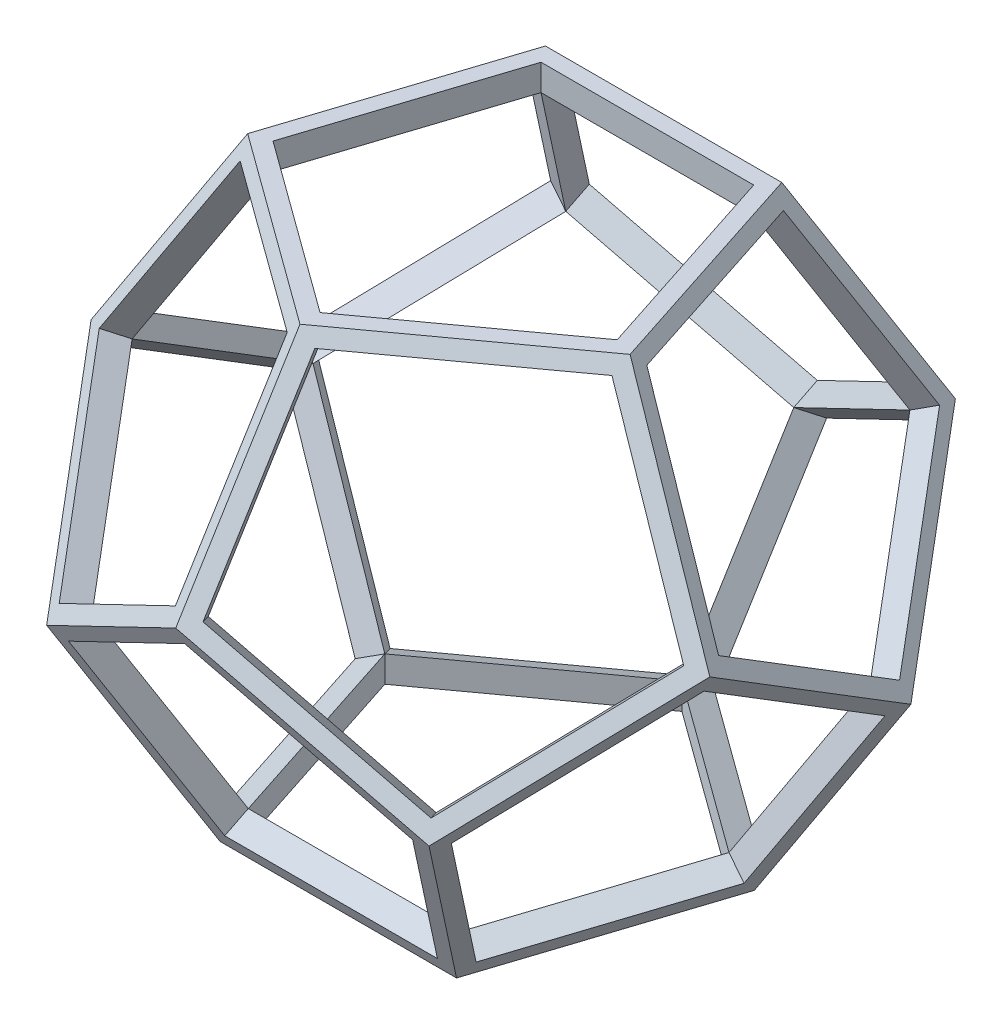
from build123d import *

# Parameters (mm, degrees)
CREATION_EXTRUDE_DEPTH = 130.901699304
CREATION_EXTRUDE_TAPER = -26.56505118
SKETCH2_OUTSIDE_W      = 455.432
SKETCH2_OUTSIDE_H      = 443.246
CREATION_CUT_DEPTH     = 130.901699304
CREATION_CUT_TAPER     = 26.56505118
CUT_EXTRUDE_A_DEPTH    = 25.4
A_INV_DEPTH            = 25.4
CUT_EXTRUDE_B_DEPTH    = 25.4
B_INV_DEPTH            = 25.4
CUT_EXTRUDE_C_DEPTH    = 25.4
C_INV_DEPTH            = 25.4
CUT_EXTRUDE_D_DEPTH    = 25.4
D_INV_DEPTH            = 25.4
CUT_EXTRUDE_E_DEPTH    = 25.4
E_INV_DEPTH            = 25.4
CUT_EXTRUDE_F_DEPTH    = 25.4
F_INV_DEPTH            = 25.4


with BuildPart() as part:
    # Sketch1 → creation_extrude (new body)
    with BuildSketch(Plane(origin=(0, 0, 0), x_dir=(1, 0, 0), z_dir=(0, 1, 0))):
        Polygon((0, 49.999999949), (-47.552825766, 15.450849703), (-29.389262585, -40.450849677), (29.389262585, -40.450849677), (47.552825766, 15.450849703), align=None)
    extrude(amount=CREATION_EXTRUDE_DEPTH, taper=CREATION_EXTRUDE_TAPER)

    # Sketch2 outside → creation_cut (cut)
    with BuildSketch(Plane(origin=(0, 130.901699304, 0), x_dir=(1, 0, 0), z_dir=(0, 1, 0))):
        with Locations((0, 12.5)):
            Rectangle(SKETCH2_OUTSIDE_W, SKETCH2_OUTSIDE_H)
        Polygon((0, -49.999999949), (47.552825766, -15.450849703), (29.389262585, 40.450849677), (-29.389262585, 40.450849677), (-47.552825766, -15.450849703), align=None, mode=Mode.SUBTRACT)
    extrude(amount=-CREATION_CUT_DEPTH, taper=CREATION_CUT_TAPER, mode=Mode.SUBTRACT)

    # Sketch3 → Cut-Extrude A (cut)
    with BuildSketch(Plane(origin=(0, 130.901699304, 0), x_dir=(1, 0, 0), z_dir=(0, 1, 0))):
        Polygon((0, -44.999999954), (42.79754319, -13.905764733), (26.450336326, 36.40576471), (-26.450336326, 36.40576471), (-42.79754319, -13.905764733), align=None)
    extrude(amount=-CUT_EXTRUDE_A_DEPTH, mode=Mode.SUBTRACT)

    # Sketch4 → A_inv (cut)
    with BuildSketch(Plane.XZ):
        Polygon((0, -44.999999954), (42.79754319, -13.905764733), (26.450336326, 36.40576471), (-26.450336326, 36.40576471), (-42.79754319, -13.905764733), align=None)
    extrude(amount=-A_INV_DEPTH, mode=Mode.SUBTRACT)

    # Sketch5 → Cut-Extrude B (cut)
    with BuildSketch(Plane(origin=(0, 42.360679738, -84.721359466), x_dir=(-1, 0, 0), z_dir=(-9.08060963965006e-15, 0.4472135955455734, -0.8944271909771081))):
        Polygon((-42.797543189, 44.635254864), (1e-09, 13.541019643), (42.79754319, 44.635254866), (26.450336325, 94.946784308), (-26.450336327, 94.946784307), align=None)
    extrude(amount=-CUT_EXTRUDE_B_DEPTH, mode=Mode.SUBTRACT)

    # Sketch6 → B_inv (cut)
    with BuildSketch(Plane(origin=(0, -16.180339872, 32.36067974), x_dir=(1, 0, 0), z_dir=(4.012362398915141e-15, -0.44721359554557344, 0.8944271909771081))):
        Polygon((-42.797543187, 72.446784338), (-26.450336325, 22.135254895), (26.450336328, 22.135254894), (42.797543192, 72.446784336), (3e-09, 103.541019559), align=None)
    extrude(amount=-B_INV_DEPTH, mode=Mode.SUBTRACT)

    # Sketch7 → Cut-Extrude C (cut)
    with BuildSketch(Plane(origin=(80.574800989, 42.360679738, -26.180339862), x_dir=(-0.24464430830200606, -0.12861712429362887, -0.9610446387935736), z_dir=(0.8506508083303457, 0.44721359554557377, -0.2763932022429817))):
        Polygon((35.93427446, 50.325575991), (12.522250638, 97.763517638), (-39.828626118, 90.15648997), (-48.771223472, 38.017146671), (-1.947175829, 13.400288029), align=None)
    extrude(amount=-CUT_EXTRUDE_C_DEPTH, mode=Mode.SUBTRACT)

    # Sketch8 → C_inv (cut)
    with BuildSketch(Plane(origin=(-30.776835339, -16.180339872, 9.999999989), x_dir=(0.2446443083020028, 0.12861712429362696, 0.9610446387935747), z_dir=(-0.8506508083303469, -0.4472135955455736, 0.27639320224297786))):
        Polygon((-31.935023341, 77.848060657), (-22.992425992, 25.708717357), (29.358450763, 18.101689683), (52.77047459, 65.539631327), (14.889024305, 102.464919293), align=None)
    extrude(amount=-C_INV_DEPTH, mode=Mode.SUBTRACT)

    # Sketch9 → Cut-Extrude D (cut)
    with BuildSketch(Plane(origin=(49.797965648, 42.360679738, 68.541019594), x_dir=(0.8506508083603209, -0.27639320226847824, -0.44721359547279954), z_dir=(0.5257311121057348, 0.44721359554557366, 0.7236067977315217))):
        Polygon((-4.184405192, 98.473361345), (-54.495934634, 82.126154482), (-54.495934634, 29.22548183), (-4.184405192, 12.878274966), (26.90983003, 55.675818156), align=None)
    extrude(amount=-CUT_EXTRUDE_D_DEPTH, mode=Mode.SUBTRACT)

    # Sketch10 → D_inv (cut)
    with BuildSketch(Plane(origin=(-19.021130306, -16.180339872, -26.180339859), x_dir=(-0.8506508083603233, 0.27639320226847536, 0.44721359547279665), z_dir=(-0.5257311121057309, -0.44721359554557344, -0.7236067977315247))):
        Polygon((31.995934659, 98.473361351), (-18.315594783, 82.126154488), (-18.315594783, 29.225481836), (31.995934659, 12.878274972), (63.090169881, 55.675818162), align=None)
    extrude(amount=-D_INV_DEPTH, mode=Mode.SUBTRACT)

    # Sketch11 → Cut-Extrude E (cut)
    with BuildSketch(Plane(origin=(-49.797965648, 42.360679738, 68.541019594), x_dir=(0.8506508083603298, 0.2763932022684677, 0.447213595472789), z_dir=(-0.5257311121057203, 0.44721359554557355, 0.7236067977315324))):
        Polygon((4.184405192, 98.473361345), (-26.90983003, 55.675818156), (4.184405192, 12.878274966), (54.495934634, 29.22548183), (54.495934634, 82.126154482), align=None)
    extrude(amount=-CUT_EXTRUDE_E_DEPTH, mode=Mode.SUBTRACT)

    # Sketch12 → E_inv (cut)
    with BuildSketch(Plane(origin=(19.021130306, -16.180339872, -26.180339859), x_dir=(-0.8506508083603274, -0.27639320226847064, -0.44721359547279194), z_dir=(0.5257311121057243, -0.44721359554557355, -0.7236067977315294))):
        Polygon((-31.99593466, 98.473361351), (-63.090169881, 55.67581816), (-31.995934658, 12.878274972), (18.315594784, 29.225481837), (18.315594782, 82.126154489), align=None)
    extrude(amount=-E_INV_DEPTH, mode=Mode.SUBTRACT)

    # Sketch13 → Cut-Extrude F (cut)
    with BuildSketch(Plane(origin=(-80.574800989, 42.360679738, -26.180339862), x_dir=(-0.2446443083019911, 0.12861712429362016, 0.9610446387935785), z_dir=(-0.8506508083303512, 0.44721359554557344, -0.2763932022429644))):
        Polygon((-12.522250637, 97.763517637), (-35.934274461, 50.325575991), (1.947175826, 13.400288027), (48.771223471, 38.017146666), (39.828626119, 90.156489966), align=None)
    extrude(amount=-CUT_EXTRUDE_F_DEPTH, mode=Mode.SUBTRACT)

    # Sketch14 → F_inv (cut)
    with BuildSketch(Plane(origin=(30.776835339, -16.180339872, 9.999999989), x_dir=(0.2446443083019939, -0.12861712429362177, -0.9610446387935776), z_dir=(0.8506508083303502, -0.4472135955455736, 0.2763932022429676))):
        Polygon((-29.358450768, 18.101689686), (22.992425988, 25.708717353), (31.935023344, 77.848060652), (-14.889024299, 102.464919294), (-52.770474589, 65.539631333), align=None)
    extrude(amount=-F_INV_DEPTH, mode=Mode.SUBTRACT)


with BuildPart() as f_inv_kept_piece:
    # of the separate pieces the step leaves, the one the design keeps (f_inv_pieces_kept)
    add(part.part.solids().sort_by_distance((0, 0, -49.999999949))[0])


solid = f_inv_kept_piece.part
